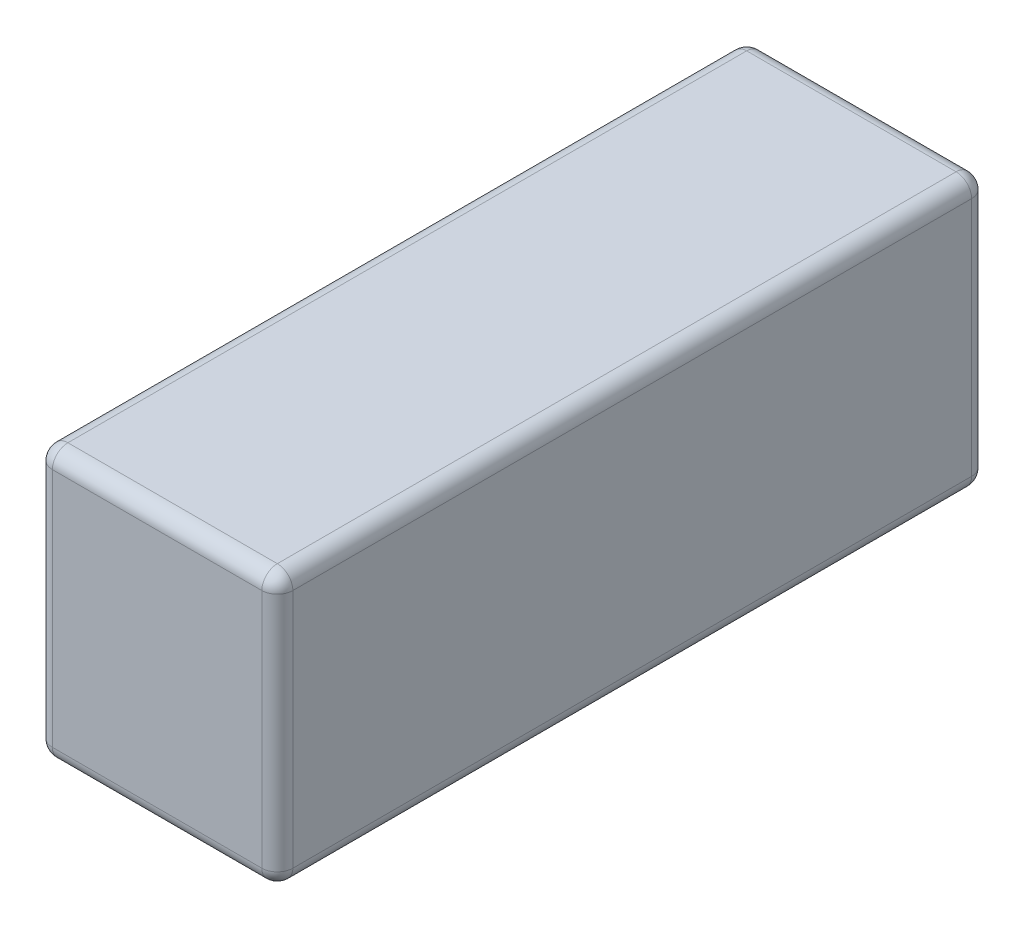
from build123d import *

# Parameters (mm, degrees)
CROQUIS1_W              = 31
CROQUIS1_H              = 35
SALIENTE_EXTRUIR1_DEPTH = 91.5
REDONDEO1_R             = 2


with BuildPart() as part:
    # Croquis1 → Saliente-Extruir1 (new body)
    with BuildSketch(Plane.XY):
        Rectangle(CROQUIS1_W, CROQUIS1_H)
    extrude(amount=SALIENTE_EXTRUIR1_DEPTH)

    # Redondeo1
    redondeo1_edges = [part.edges().sort_by_distance(p)[0] for p in [
        (-15.5, 0, 91.5),
        (0, -17.5, 91.5),
        (15.5, 0, 91.5),
        (0, -17.5, 0),
        (-15.5, 0, 0),
        (0, 17.5, 0),
        (15.5, 0, 0),
        (15.5, -17.5, 45.75),
        (-15.5, -17.5, 45.75),
        (-15.5, 17.5, 45.75),
        (15.5, 17.5, 45.75),
        (0, 17.5, 91.5),
    ]]
    fillet(redondeo1_edges, radius=REDONDEO1_R)


solid = part.part
